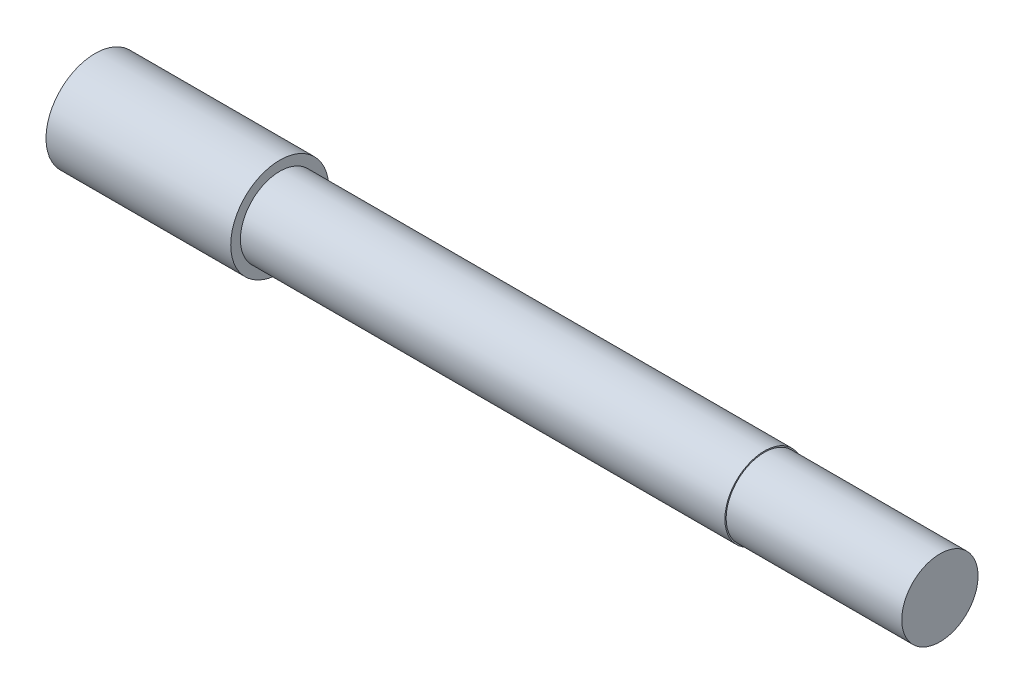
from build123d import *


with BuildPart() as part:
    # Esquisse1 → Révolution1 (revolve)
    with BuildSketch(Plane.XY, mode=Mode.PRIVATE) as r_volution1_sk:
        Polygon((0, 0), (0, 8.1), (30.5, 8.1), (30.5, 6.5), (110.5, 6.5), (110.5, 6.3), (139.5, 6.3), (139.5, 0), align=None)
    revolve(r_volution1_sk.sketch.rotate(Axis((0, 0, 0), (1, 0, 0)), 90), axis=Axis((0, 0, 0), (1, 0, 0)))


solid = part.part
